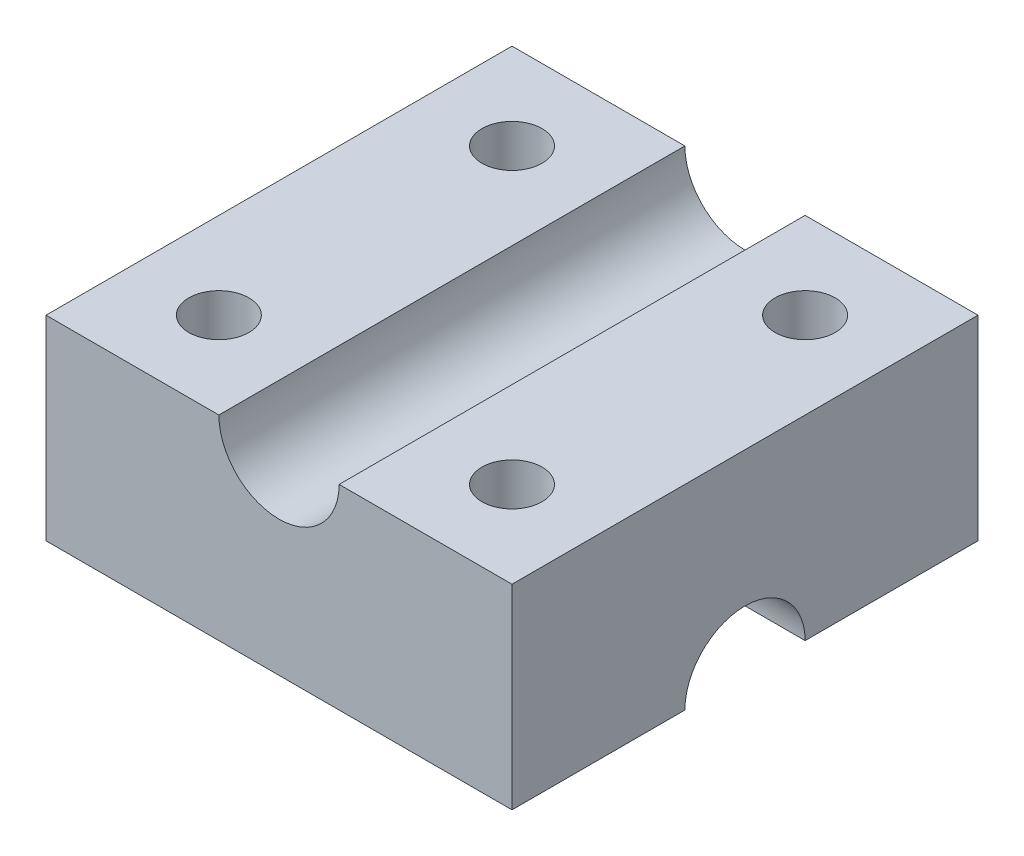
from build123d import *

# Parameters (mm, degrees)
P_IDAT_VYSUNUT_M1_DEPTH  = 31
SKICA2_R                 = 4
ODEBRAT_VYSUNUT_M1_DEPTH = 45.319860108
SKICA3_R                 = 2
ODEBRAT_VYSUNUT_M2_DEPTH = 38.016888038
SKICA4_R                 = 2
ODEBRAT_VYSUNUT_M3_DEPTH = 10


with BuildPart() as part:
    # Skica1 → Přidat vysunutím1 (new body)
    with BuildSketch(Plane.XY):
        with BuildLine():
            Line((-15.5, 6.5), (-4, 6.5))
            ThreePointArc((-4, 6.5), (0, 2.5), (4, 6.5))
            Line((4, 6.5), (15.5, 6.5))
            Line((15.5, 6.5), (15.5, -6.5))
            Line((15.5, -6.5), (-15.5, -6.5))
            Line((-15.5, -6.5), (-15.5, 6.5))
        make_face()
    extrude(amount=P_IDAT_VYSUNUT_M1_DEPTH)

    # Skica2 → Odebrat vysunutím1 (cut, through all)
    with BuildSketch(Plane.ZY.offset(15.5)):
        with Locations((15.5, -6.5)):
            Circle(SKICA2_R)
    extrude(amount=-ODEBRAT_VYSUNUT_M1_DEPTH, mode=Mode.SUBTRACT)

    # Skica3 → Odebrat vysunutím2 (cut, through all)
    with BuildSketch(Plane(origin=(0, 6.5, 0), x_dir=(1, 0, 0), z_dir=(0, 1, 0))):
        with Locations(Location((9.75, -5.75, 0), (0, 0, 270))):
            Circle(SKICA3_R)
        with Locations(Location((9.75, -25.25, 0), (0, 0, 90))):
            Circle(SKICA3_R)
        with Locations(Location((-9.75, -25.25, 0), (0, 0, 270))):
            Circle(SKICA3_R)
        with Locations(Location((-9.75, -5.75, 0), (0, 0, 90))):
            Circle(SKICA3_R)
    extrude(amount=-ODEBRAT_VYSUNUT_M2_DEPTH, mode=Mode.SUBTRACT)

    # Skica4 → Odebrat vysunutím3 (cut)
    with BuildSketch(Plane.ZY.offset(15.5)):
        with Locations((15.5, 1.5)):
            Circle(SKICA4_R)
    extrude(amount=-ODEBRAT_VYSUNUT_M3_DEPTH, mode=Mode.SUBTRACT)


solid = part.part
